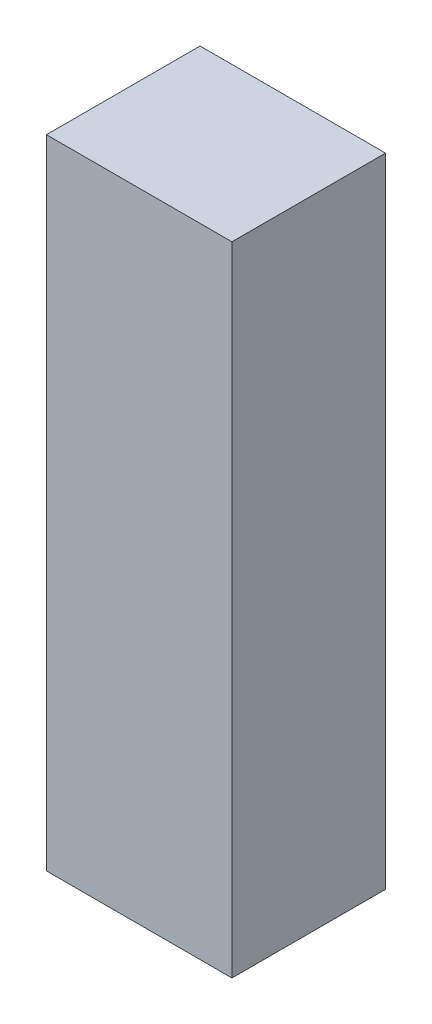
from build123d import *

# Parameters (mm, degrees)
ESBO_O1_W                = 32
ESBO_O1_H                = 110
RESSALTO_EXTRUS_O1_DEPTH = 26.5


with BuildPart() as part:
    # Esboço1 → Ressalto-extrusão1 (new body)
    with BuildSketch(Plane.XY):
        Rectangle(ESBO_O1_W, ESBO_O1_H)
    extrude(amount=RESSALTO_EXTRUS_O1_DEPTH)


solid = part.part
